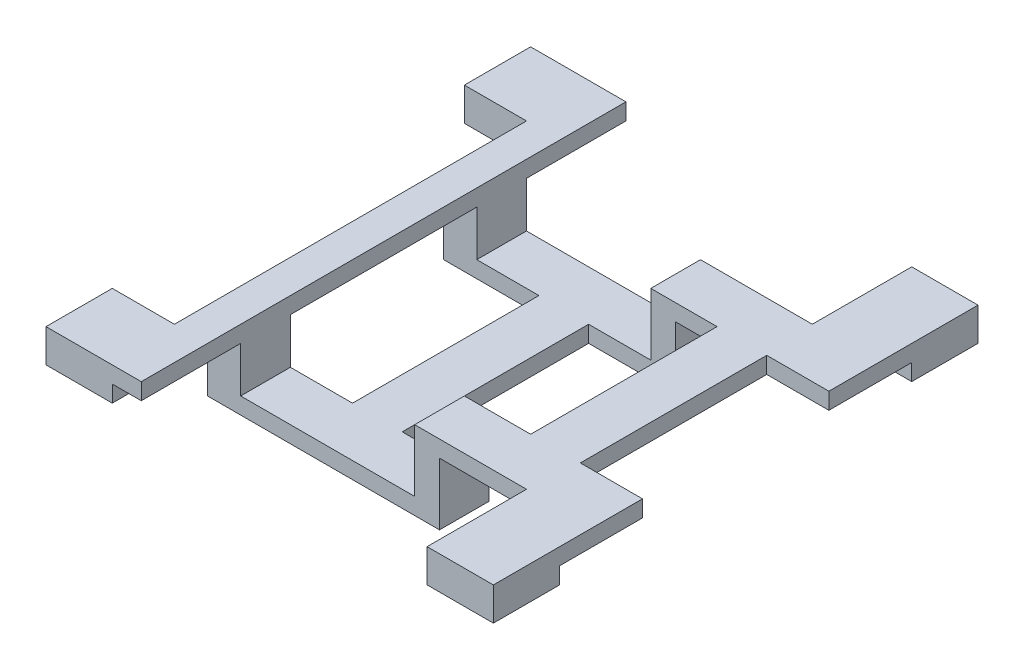
from build123d import *

# Parameters (mm, degrees)
SKETCH1_W                       = 113
SKETCH1_H                       = 85
BOSS_EXTRUDE1_DEPTH             = 4
BOSS_EXTRUDE3_REACH             = 72.813
SKETCH4_W                       = 16
SKETCH4_H                       = 16
BOSS_EXTRUDE3_DIRECTION_2_DEPTH = 1
SKETCH10_W                      = 10
SKETCH10_H                      = 16
BOSS_EXTRUDE6_DEPTH             = 4
SKETCH6_W                       = 73
SKETCH6_H                       = 45
SKETCH6_W_2                     = 15
SKETCH6_H_2                     = 85
SKETCH6_W_3                     = 66
SKETCH6_H_3                     = 8
CUT_EXTRUDE2_DEPTH              = 82.483127088
SKETCH8_R                       = 6.1
CUT_EXTRUDE3_DEPTH              = 3.2
SKETCH9_W                       = 16
SKETCH9_H                       = 16
SKETCH9_W_2                     = 14
SKETCH9_H_2                     = 14
BOSS_EXTRUDE5_DEPTH             = 3
FILLET1_R                       = 0.2
SKETCH13_W                      = 85
SKETCH13_H                      = 4
CUT_EXTRUDE4_DEPTH              = 5
SKETCH14_W                      = 93
SKETCH14_H                      = 45
CUT_EXTRUDE5_DEPTH              = 82.722090037
SKETCH15_W                      = 12
SKETCH15_H                      = 45
BOSS_EXTRUDE7_DEPTH             = 4
BOSS_EXTRUDE8_DEPTH             = 15
SKETCH17_W                      = 42
SKETCH17_H                      = 117
CUT_EXTRUDE6_DEPTH              = 15
SKETCH18_W                      = 8
SKETCH18_H                      = 45
BOSS_EXTRUDE9_DEPTH             = 4


with BuildPart() as part:
    # Sketch1 → Boss-Extrude1 (new body)
    with BuildSketch(Plane(origin=(0, 0, 0), x_dir=(1, 0, 0), z_dir=(0, 1, 0))):
        Rectangle(SKETCH1_W, SKETCH1_H)
    extrude(amount=BOSS_EXTRUDE1_DEPTH)

    # Boss-Extrude3: up to this face of the body (flat: up to its plane)
    boss_extrude3_end = Plane(part.part.faces().sort_by_distance((0, 4, 0))[0])
    # Sketch4 → Boss-Extrude3 (add, up to the picked face)
    with BuildSketch(Plane.XZ, mode=Mode.PRIVATE) as boss_extrude3_sk1:
        with Locations((-48.5, 50.5)):
            Rectangle(SKETCH4_W, SKETCH4_H)
    boss_extrude3_tool1 = split(extrude(boss_extrude3_sk1.sketch, amount=-BOSS_EXTRUDE3_REACH, mode=Mode.PRIVATE), bisect_by=boss_extrude3_end, keep=Keep.BOTH, mode=Mode.PRIVATE)
    # Sketch4 → Boss-Extrude3 (add, up to the picked face)
    with BuildSketch(Plane.XZ, mode=Mode.PRIVATE) as boss_extrude3_sk2:
        with Locations((43.5, 50.5)):
            Rectangle(SKETCH4_W, SKETCH4_H)
    boss_extrude3_tool2 = split(extrude(boss_extrude3_sk2.sketch, amount=-BOSS_EXTRUDE3_REACH, mode=Mode.PRIVATE), bisect_by=boss_extrude3_end, keep=Keep.BOTH, mode=Mode.PRIVATE)
    # Sketch4 → Boss-Extrude3 (add, up to the picked face)
    with BuildSketch(Plane.XZ, mode=Mode.PRIVATE) as boss_extrude3_sk3:
        with Locations((43.5, -50.5)):
            Rectangle(SKETCH4_W, SKETCH4_H)
    boss_extrude3_tool3 = split(extrude(boss_extrude3_sk3.sketch, amount=-BOSS_EXTRUDE3_REACH, mode=Mode.PRIVATE), bisect_by=boss_extrude3_end, keep=Keep.BOTH, mode=Mode.PRIVATE)
    # Sketch4 → Boss-Extrude3 (add, up to the picked face)
    with BuildSketch(Plane.XZ, mode=Mode.PRIVATE) as boss_extrude3_sk4:
        with Locations((-48.5, -50.5)):
            Rectangle(SKETCH4_W, SKETCH4_H)
    boss_extrude3_tool4 = split(extrude(boss_extrude3_sk4.sketch, amount=-BOSS_EXTRUDE3_REACH, mode=Mode.PRIVATE), bisect_by=boss_extrude3_end, keep=Keep.BOTH, mode=Mode.PRIVATE)
    add(boss_extrude3_tool1.solids().sort_by(Axis((-48.5, 0, 50.5), (0, 1, 0)))[0])
    add(boss_extrude3_tool2.solids().sort_by(Axis((43.5, 0, 50.5), (0, 1, 0)))[0])
    add(boss_extrude3_tool3.solids().sort_by(Axis((43.5, 0, -50.5), (0, 1, 0)))[0])
    add(boss_extrude3_tool4.solids().sort_by(Axis((-48.5, 0, -50.5), (0, 1, 0)))[0])

    # Sketch4 → Boss-Extrude3 direction 2 (add)
    with BuildSketch(Plane.XZ):
        with Locations((-48.5, 50.5)):
            Rectangle(SKETCH4_W, SKETCH4_H)
        with Locations((43.5, 50.5)):
            Rectangle(SKETCH4_W, SKETCH4_H)
        with Locations((43.5, -50.5)):
            Rectangle(SKETCH4_W, SKETCH4_H)
        with Locations((-48.5, -50.5)):
            Rectangle(SKETCH4_W, SKETCH4_H)
    extrude(amount=BOSS_EXTRUDE3_DIRECTION_2_DEPTH)

    # Sketch10 → Boss-Extrude6 (add)
    with BuildSketch(Plane(origin=(0, 4, 0), x_dir=(1, 0, 0), z_dir=(0, 1, 0))):
        with Locations((-35.5, -50.5)):
            Rectangle(SKETCH10_W, SKETCH10_H)
        with Locations((-35.5, 50.5)):
            Rectangle(SKETCH10_W, SKETCH10_H)
    extrude(amount=-BOSS_EXTRUDE6_DEPTH)

    # Sketch6 → Cut-Extrude2 (cut, through all)
    with BuildSketch(Plane(origin=(0, 4, 0), x_dir=(1, 0, 0), z_dir=(0, 1, 0))):
        with Locations((5, 0)):
            Rectangle(SKETCH6_W, SKETCH6_H)
        with Locations((-49, 0)):
            Rectangle(SKETCH6_W_2, SKETCH6_H_2)
        with Locations((2.5, 38.5)):
            Rectangle(SKETCH6_W_3, SKETCH6_H_3)
        with Locations((2.5, -38.5)):
            Rectangle(SKETCH6_W_3, SKETCH6_H_3)
    extrude(amount=-CUT_EXTRUDE2_DEPTH, mode=Mode.SUBTRACT)

    # Sketch8 → Cut-Extrude3 (cut)
    with BuildSketch(Plane.XZ.offset(1)):
        with Locations(Location((-48.5, 50.5, 0), (0, 0, 270))):
            Circle(SKETCH8_R)
        with Locations(Location((43.5, 50.5, 0), (0, 0, 270))):
            Circle(SKETCH8_R)
        with Locations(Location((43.5, -50.5, 0), (0, 0, 90))):
            Circle(SKETCH8_R)
        with Locations(Location((-48.5, -50.5, 0), (0, 0, 90))):
            Circle(SKETCH8_R)
    extrude(amount=-CUT_EXTRUDE3_DEPTH, mode=Mode.SUBTRACT)

    # Sketch9 → Boss-Extrude5 (add)
    # profile 1 of 4: a face of its own
    with BuildSketch(Plane.XZ.offset(1)):
        with Locations((-48.5, 50.5)):
            Rectangle(SKETCH9_W, SKETCH9_H)
        with Locations((-48.5, 50.5)):
            Rectangle(SKETCH9_W_2, SKETCH9_H_2, mode=Mode.SUBTRACT)
    # profile 2 of 4: a face of its own
    with BuildSketch(Plane.XZ.offset(1)):
        with Locations((43.5, 50.5)):
            Rectangle(SKETCH9_W, SKETCH9_H)
        with Locations((43.5, 50.5)):
            Rectangle(SKETCH9_W_2, SKETCH9_H_2, mode=Mode.SUBTRACT)
    # profile 3 of 4: a face of its own
    with BuildSketch(Plane.XZ.offset(1)):
        with Locations((43.5, -50.5)):
            Rectangle(SKETCH9_W, SKETCH9_H)
        with Locations((43.5, -50.5)):
            Rectangle(SKETCH9_W_2, SKETCH9_H_2, mode=Mode.SUBTRACT)
    # profile 4 of 4: a face of its own
    with BuildSketch(Plane.XZ.offset(1)):
        with Locations((-48.5, -50.5)):
            Rectangle(SKETCH9_W, SKETCH9_H)
        with Locations((-48.5, -50.5)):
            Rectangle(SKETCH9_W_2, SKETCH9_H_2, mode=Mode.SUBTRACT)
    extrude(amount=BOSS_EXTRUDE5_DEPTH)

    # Fillet1
    fillet1_edges = [part.edges().sort_by_distance(p)[0] for p in [
        (-48.5, -1, -56.6),
        (43.5, -1, -56.6),
        (43.5, -1, 56.6),
        (-48.5, -1, 56.6),
    ]]
    fillet(fillet1_edges, radius=FILLET1_R)

    # Sketch13 → Cut-Extrude4 (cut)
    with BuildSketch(Plane(origin=(56.5, 0, 0), x_dir=(0, 0, -1), z_dir=(1, 0, 0))):
        with Locations((0, 2)):
            Rectangle(SKETCH13_W, SKETCH13_H)
    extrude(amount=-CUT_EXTRUDE4_DEPTH, mode=Mode.SUBTRACT)

    # Sketch14 → Cut-Extrude5 (cut, through all)
    with BuildSketch(Plane(origin=(0, 4, 0), x_dir=(1, 0, 0), z_dir=(0, 1, 0))):
        with Locations((5, 0)):
            Rectangle(SKETCH14_W, SKETCH14_H)
    extrude(amount=-CUT_EXTRUDE5_DEPTH, mode=Mode.SUBTRACT)


with BuildPart() as cut_extrude5_piece_1:
    # of the separate pieces the step leaves, piece 1, a body of its own (cut_extrude5_pieces)
    add(part.part.solids().sort_by_distance((-40.5, 0, -42.5))[0])



with BuildPart() as cut_extrude5_piece_2:
    # of the separate pieces the step leaves, piece 2, a body of its own (cut_extrude5_pieces)
    add(part.part.solids().sort_by_distance((-48.5, -1, 44.2))[0])


with BuildPart() as cut_extrude5_piece_1_1:
    add(cut_extrude5_piece_1.part)

    add(cut_extrude5_piece_2.part)  # Boss-Extrude7 merges Cut-Extrude5 piece 2
    # Sketch15 → Boss-Extrude7 (add)
    with BuildSketch(Plane(origin=(0, 4, 0), x_dir=(1, 0, 0), z_dir=(0, 1, 0))):
        with Locations((-12.5, 0)):
            Rectangle(SKETCH15_W, SKETCH15_H)
        with Locations((30.5, 0)):
            Rectangle(SKETCH15_W, SKETCH15_H)
    extrude(amount=-BOSS_EXTRUDE7_DEPTH)

    # Sketch16 → Boss-Extrude8 (add)
    with BuildSketch(Plane.XZ):
        Polygon((-6.5, -22.5), (-6.5, 22.5), (14.5, 22.5), (14.5, 34.5), (-30.5, 34.5), (-41.5, 34.5), (-41.5, 22.5), (-18.5, 22.5), (-18.5, -22.5), (-41.5, -22.5), (-41.5, -34.5), (-30.5, -34.5), (14.5, -34.5), (14.5, -22.5), align=None)
    extrude(amount=BOSS_EXTRUDE8_DEPTH)

    # Sketch17 → Cut-Extrude6 (cut)
    with BuildSketch(Plane(origin=(0, 4, 0), x_dir=(1, 0, 0), z_dir=(0, 1, 0))):
        with Locations((-12.5, 0)):
            Rectangle(SKETCH17_W, SKETCH17_H)
    extrude(amount=-CUT_EXTRUDE6_DEPTH, mode=Mode.SUBTRACT)

    # Sketch18 → Boss-Extrude9 (add)
    with BuildSketch(Plane(origin=(0, 4, 0), x_dir=(1, 0, 0), z_dir=(0, 1, 0))):
        with Locations((-37.5, 0)):
            Rectangle(SKETCH18_W, SKETCH18_H)
    extrude(amount=-BOSS_EXTRUDE9_DEPTH)


solid = cut_extrude5_piece_1_1.part
